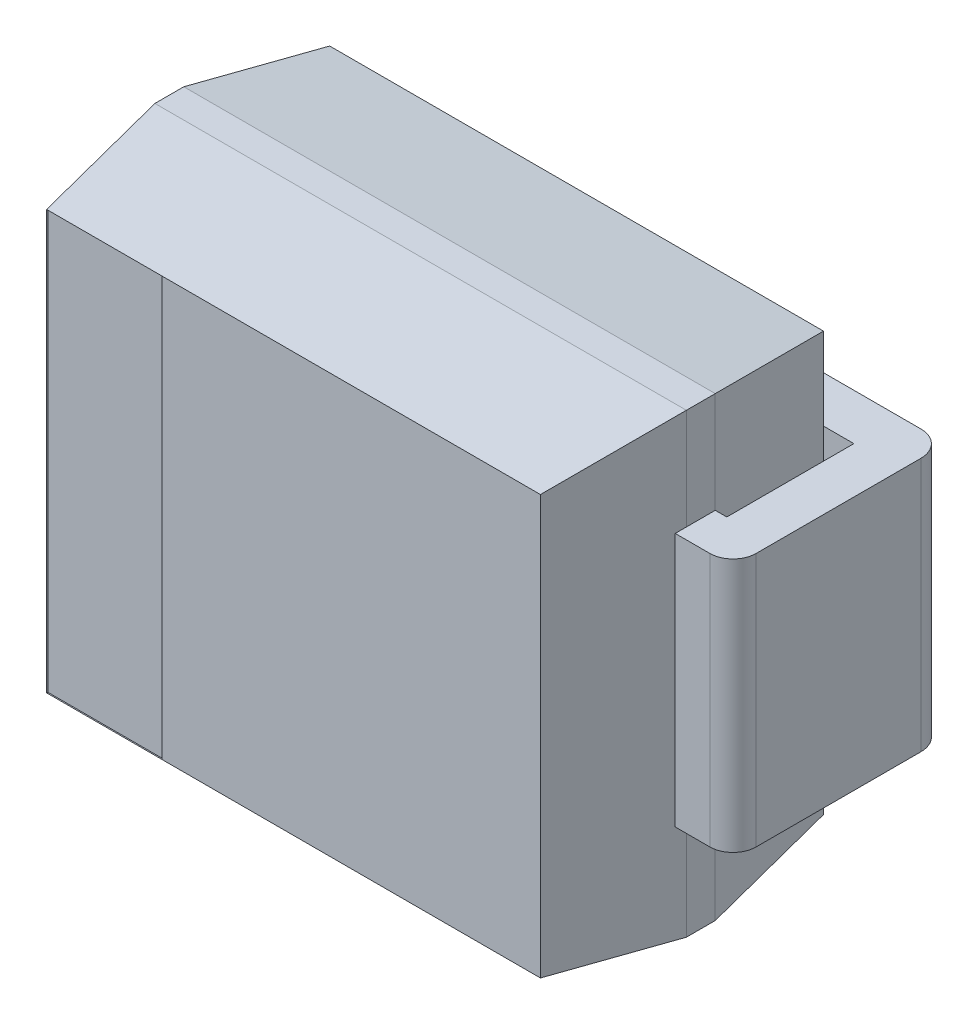
from build123d import *
from OCP.BRepFilletAPI import BRepFilletAPI_MakeChamfer

# Parameters (mm, degrees)
SKETCH_1_W           = 4.6
SKETCH_1_H           = 3.95
EXTRUDE_1_DEPTH      = 2.45
CHAMFER_1_SIZE       = 1.1
CHAMFER_1_SIZE2      = 0.163
CHAMFER_2_SIZE       = 0.163
CHAMFER_2_SIZE2      = 1.1
EXTRUDE_2_DEPTH      = 1.1
EXTRUDE_2_DEPTH_BACK = 1.1
SKETCH_3_W           = 1
SKETCH_3_H           = 3.624
CUT_EXTRUDE_1_DEPTH  = 0.01


with BuildPart() as part:
    # Эскиз1 → Бобышка-Вытянуть1 (new body)
    with BuildSketch(Plane.XY.offset(0.4)):
        Rectangle(SKETCH_1_W, SKETCH_1_H)
    extrude(amount=EXTRUDE_1_DEPTH)

    # Фаска1: one chamfer whose edges measure the first distance from different faces: ONE call of the kernel's chamfer builder (chamfer() names one face for all edges)
    chamfer_1_edges_1 = [part.edges().sort_by_distance(p)[0] for p in [
        (-2.3, 0, 2.85),
    ]]
    chamfer_1_side_1 = [part.faces().sort_by_distance(p)[0] for p in [
        (-2.3, 0, 1.625),
    ]]
    chamfer_1_edges_2 = [part.edges().sort_by_distance(p)[0] for p in [
        (0, -1.975, 2.85),
    ]]
    chamfer_1_side_2 = [part.faces().sort_by_distance(p)[0] for p in [
        (0, -1.975, 1.625),
    ]]
    chamfer_1_edges_3 = [part.edges().sort_by_distance(p)[0] for p in [
        (2.3, 0, 2.85),
    ]]
    chamfer_1_side_3 = [part.faces().sort_by_distance(p)[0] for p in [
        (2.3, 0, 1.625),
    ]]
    chamfer_1_edges_4 = [part.edges().sort_by_distance(p)[0] for p in [
        (0, 1.975, 2.85),
    ]]
    chamfer_1_side_4 = [part.faces().sort_by_distance(p)[0] for p in [
        (0, 1.975, 1.625),
    ]]
    chamfer_1 = BRepFilletAPI_MakeChamfer(part.part.solid().wrapped)
    for e in chamfer_1_edges_1:
        chamfer_1.Add(CHAMFER_1_SIZE, CHAMFER_1_SIZE2, e.wrapped, chamfer_1_side_1[0].wrapped)  # the first distance lies on this face
    for e in chamfer_1_edges_2:
        chamfer_1.Add(CHAMFER_1_SIZE, CHAMFER_1_SIZE2, e.wrapped, chamfer_1_side_2[0].wrapped)  # the first distance lies on this face
    for e in chamfer_1_edges_3:
        chamfer_1.Add(CHAMFER_1_SIZE, CHAMFER_1_SIZE2, e.wrapped, chamfer_1_side_3[0].wrapped)  # the first distance lies on this face
    for e in chamfer_1_edges_4:
        chamfer_1.Add(CHAMFER_1_SIZE, CHAMFER_1_SIZE2, e.wrapped, chamfer_1_side_4[0].wrapped)  # the first distance lies on this face
    add(Compound.cast(chamfer_1.Shape()), mode=Mode.REPLACE)

    # Фаска2
    chamfer_2_edges = [part.edges().sort_by_distance(p)[0] for p in [
        (0, -1.975, 0.4),
        (-2.3, 0, 0.4),
        (0, 1.975, 0.4),
        (2.3, 0, 0.4),
    ]]
    chamfer_2_side = [part.faces().sort_by_distance(p)[0] for p in [
        (0, 0, 0.4),
    ]]
    chamfer(chamfer_2_edges, length=CHAMFER_2_SIZE, length2=CHAMFER_2_SIZE2, reference=chamfer_2_side[0])

    # Эскиз3 → Вырез-Вытянуть1 (cut)
    with BuildSketch(Plane.XY.offset(2.85)):
        with Locations((-1.637, 0)):
            Rectangle(SKETCH_3_W, SKETCH_3_H)
    extrude(amount=-CUT_EXTRUDE_1_DEPTH, mode=Mode.SUBTRACT)


with BuildPart() as body_2:
    # Эскиз2 → Бобышка-Вытянуть2 (new, two sides: drawn at the far end of the back side and taken through both)
    with BuildSketch(Plane(origin=(0, 0, 0), x_dir=(1, 0, 0), z_dir=(0, 1, 0)).offset(-EXTRUDE_2_DEPTH_BACK)):
        with BuildLine():
            Line((-2.4, -0.4), (-2.4, -1.5))
            Line((-2.4, -1.5), (-2.3, -1.5))
            Line((-2.3, -1.5), (-2.3, -1.846410162))
            Line((-2.3, -1.846410162), (-2.6, -1.846410162))
            ThreePointArc((-2.6, -1.846410162), (-2.741421356, -1.787831518), (-2.8, -1.646410162))
            Line((-2.8, -1.646410162), (-2.8, -0.22))
            ThreePointArc((-2.8, -0.22), (-2.735563492, -0.064436508), (-2.58, 0))
            Line((-2.58, 0), (-1.3, 0))
            Line((-1.3, 0), (-1.3, -0.4))
            Line((-1.3, -0.4), (-2.4, -0.4))
        make_face()
    extrude(amount=EXTRUDE_2_DEPTH + EXTRUDE_2_DEPTH_BACK)


with BuildPart() as body_3:
    # Зеркальное отражение1: mirrored copy
    add(body_2.part.mirror(Plane(origin=(0, 0, 0), x_dir=(0, 0, 1), z_dir=(1, 0, 0))))


solid = Compound([part.part, body_2.part, body_3.part])
